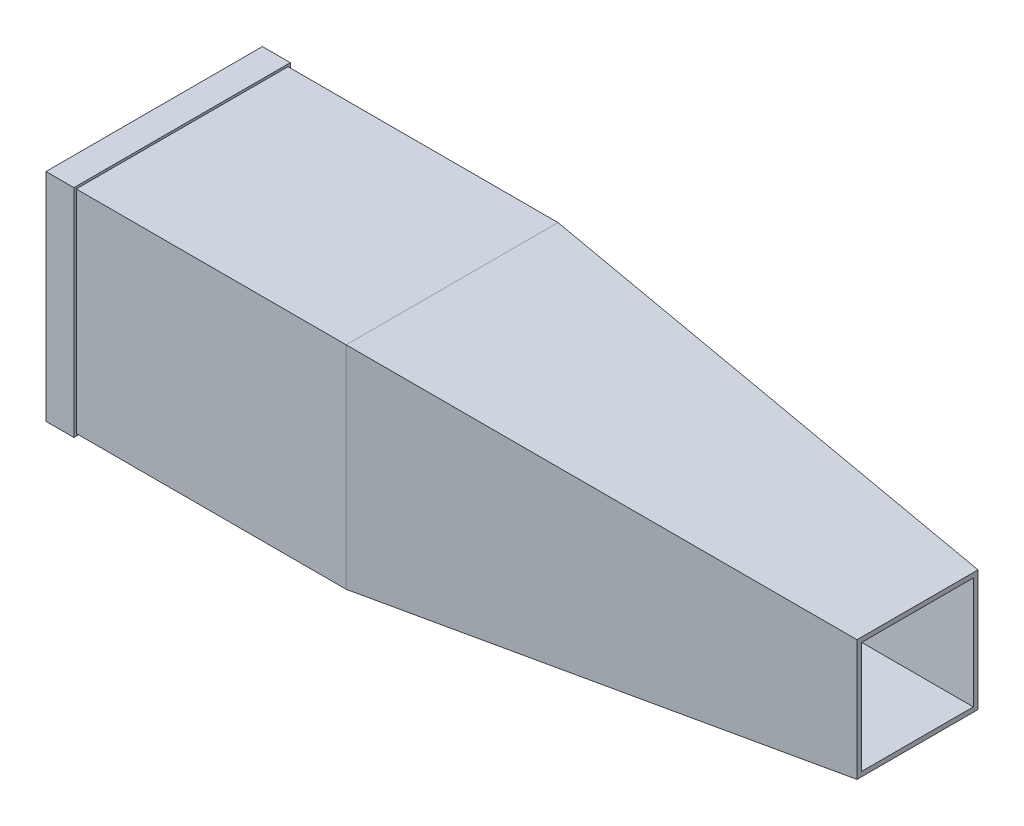
from build123d import *

# Parameters (mm, degrees)
SKETCH1_W               = 232.5
SKETCH1_H               = 232.5
SKETCH1_W_2             = 222.5
SKETCH1_H_2             = 222.5
BOSS_EXTRUDE1_DEPTH     = 30
SKETCH3_W               = 227.5
SKETCH3_H               = 227.5
SKETCH3_W_2             = 217.5
SKETCH3_H_2             = 217.5
BOSS_EXTRUDE2_DEPTH     = 300
CUT_EXTRUDE1_DEPTH      = 2
CUT_EXTRUDE1_DEPTH_BACK = 2
SKETCH8_W               = 222.5
SKETCH8_H               = 222.5
SKETCH8_W_2             = 217.5
SKETCH8_H_2             = 217.5


with BuildPart() as part:
    # Sketch1 → Boss-Extrude1 (new body)
    with BuildSketch(Plane(origin=(0, 0, 0), x_dir=(0, 0, -1), z_dir=(1, 0, 0))):
        Rectangle(SKETCH1_W, SKETCH1_H)
        Rectangle(SKETCH1_W_2, SKETCH1_H_2, mode=Mode.SUBTRACT)
    extrude(amount=BOSS_EXTRUDE1_DEPTH)

    # Sketch3 → Boss-Extrude2 (add)
    with BuildSketch(Plane(origin=(20, 0, 0), x_dir=(0, 0, -1), z_dir=(1, 0, 0))):
        Rectangle(SKETCH3_W, SKETCH3_H)
        Rectangle(SKETCH3_W_2, SKETCH3_H_2, mode=Mode.SUBTRACT)
    extrude(amount=BOSS_EXTRUDE2_DEPTH)

    # Sketch5 → Loft2 section 0
    with BuildSketch(Plane(origin=(320, 0, 0), x_dir=(0, 0, -1), z_dir=(1, 0, 0))):
        with BuildLine():
            Line((-113.75, 113.75), (113.75, 113.75))
            Line((113.75, 113.75), (113.75, -113.75))
            Line((113.75, -113.75), (-113.75, -113.75))
            Line((-113.75, -113.75), (-113.75, 113.75))
        make_face()
    # Sketch4 → Loft2 section 1
    with BuildSketch(Plane(origin=(820, 0, 0), x_dir=(0, 0, -1), z_dir=(1, 0, 0))):
        with BuildLine():
            Line((-65, 65), (65, 65))
            Line((65, 65), (65, -65))
            Line((65, -65), (-65, -65))
            Line((-65, -65), (-65, 65))
        make_face()
    loft()

    # Sketch5<5> → Cut-Loft2 section 0
    with BuildSketch(Plane(origin=(320, 0, 0), x_dir=(0, 0, -1), z_dir=(1, 0, 0))):
        with BuildLine():
            Line((-108.75, 108.75), (108.75, 108.75))
            Line((108.75, 108.75), (108.75, -108.75))
            Line((108.75, -108.75), (-108.75, -108.75))
            Line((-108.75, -108.75), (-108.75, 108.75))
        make_face()
    # Sketch4<7> → Cut-Loft2 section 1
    with BuildSketch(Plane(origin=(820, 0, 0), x_dir=(0, 0, -1), z_dir=(1, 0, 0))):
        with BuildLine():
            Line((-60, 60), (60, 60))
            Line((60, 60), (60, -60))
            Line((60, -60), (-60, -60))
            Line((-60, -60), (-60, 60))
        make_face()
    loft(mode=Mode.SUBTRACT)

    # Sketch8 → Cut-Extrude1 (cut, two sides: drawn at the far end of the back side and taken through both)
    with BuildSketch(Plane(origin=(165, 0, 0), x_dir=(0, 0, -1), z_dir=(1, 0, 0)).offset(-CUT_EXTRUDE1_DEPTH_BACK)):
        Rectangle(SKETCH8_W, SKETCH8_H)
        Rectangle(SKETCH8_W_2, SKETCH8_H_2, mode=Mode.SUBTRACT)
    extrude(amount=CUT_EXTRUDE1_DEPTH + CUT_EXTRUDE1_DEPTH_BACK, mode=Mode.SUBTRACT)


solid = part.part
